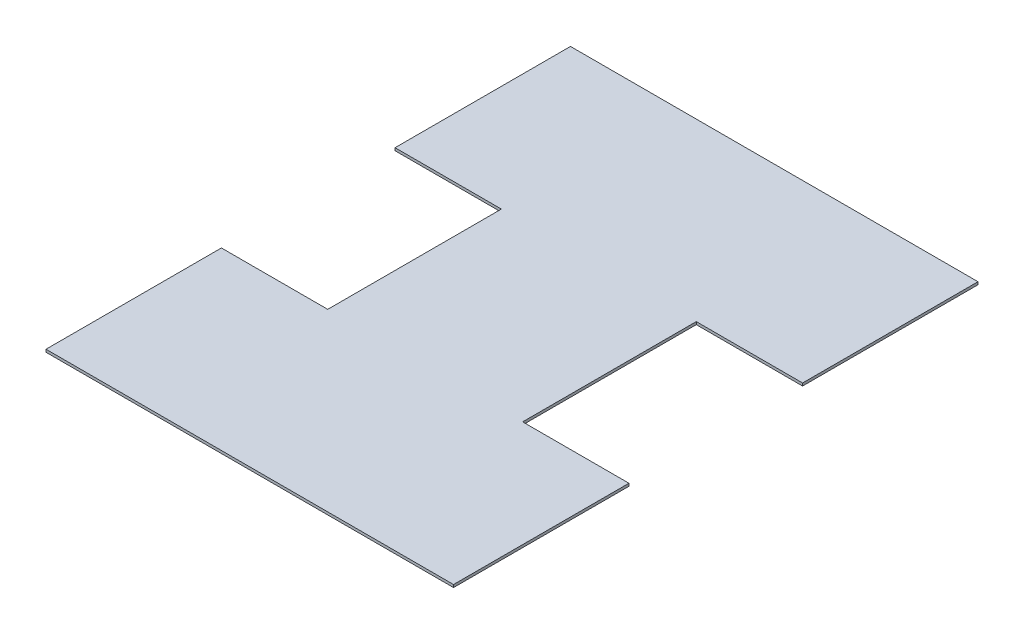
from build123d import *

# Parameters (mm, degrees)
BOSS_EXTRUDE1_DEPTH = 3


with BuildPart() as part:
    # Sketch1 → Boss-Extrude1 (new body)
    with BuildSketch(Plane(origin=(0, 0, 0), x_dir=(1, 0, 0), z_dir=(0, 1, 0))):
        Polygon((-230, -296), (230, -296), (230, -98), (110, -98), (110, 98), (230, 98), (230, 296), (-230, 296), (-230, 98), (-110, 98), (-110, -98), (-230, -98), align=None)
    extrude(amount=BOSS_EXTRUDE1_DEPTH)


solid = part.part
